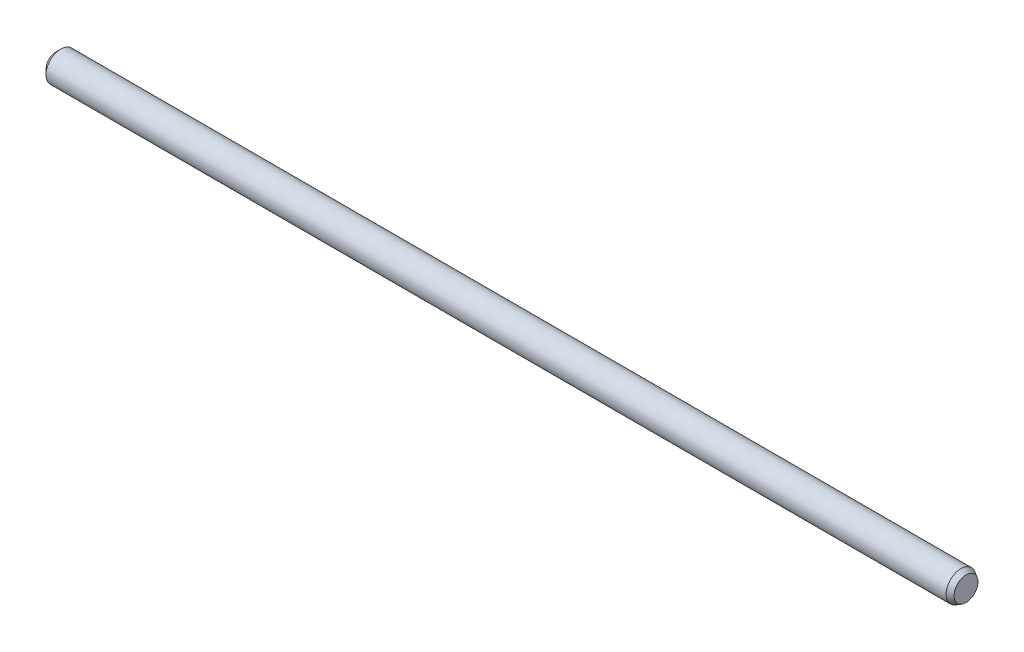
from build123d import *

# Parameters (mm, degrees)
CROQUIS1_R              = 1.475
SALIENTE_EXTRUIR1_DEPTH = 90
CHAFL_N1_SIZE           = 0.5
CHAFL_N1_SIZE2          = 0.288675135
CHAFL_N2_SIZE           = 0.5


with BuildPart() as part:
    # Croquis1 → Saliente-Extruir1 (new body)
    with BuildSketch(Plane(origin=(0, 0, 0), x_dir=(0, 0, -1), z_dir=(1, 0, 0))):
        with Locations(Location((0, 0, 0), (0, 0, 180))):
            Circle(CROQUIS1_R)
    extrude(amount=SALIENTE_EXTRUIR1_DEPTH)

    # Chaflán1
    chafl_n1_edges = [part.edges().sort_by_distance(p)[0] for p in [
        (90, 0, -1.475),
    ]]
    chafl_n1_side = [part.faces().sort_by_distance(p)[0] for p in [
        (45, 0, -1.475),
    ]]
    chamfer(chafl_n1_edges, length=CHAFL_N1_SIZE, length2=CHAFL_N1_SIZE2, reference=chafl_n1_side[0])

    # Chaflán2
    chafl_n2_edges = [part.edges().sort_by_distance(p)[0] for p in [
        (0, 0, -1.475),
    ]]
    chamfer(chafl_n2_edges, length=CHAFL_N2_SIZE)


solid = part.part
